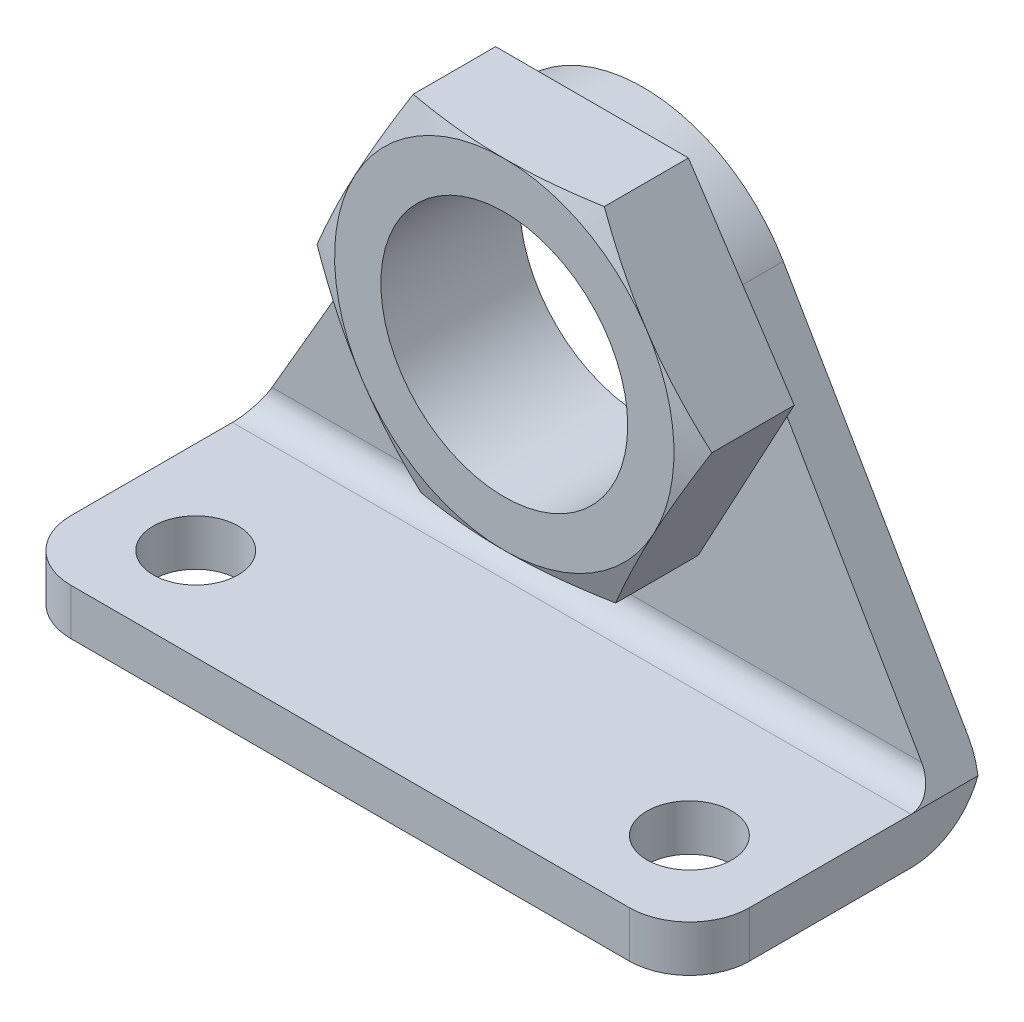
from build123d import *

# Parameters (mm, degrees)
EXTRUDE_START                   = -22
EXTRUDE_1_DEPTH                 = 44
CUT_EXTRUDE_1_DEPTH             = 10
CUT_EXTRUDE_1_DIRECTION_2_REACH = 42.869
SKETCH_6_R                      = 8
CUT_EXTRUDE_2_DEPTH             = 41.868692174
SKETCH_7_R                      = 2.75
CUT_EXTRUDE_3_DEPTH             = 41.015621949
FILLET_1_R                      = 3.9
EXTRUDE_2_DEPTH                 = 6
SKETCH_11_R                     = 8
CUT_EXTRUDE_4_DEPTH             = 42.243181255


with BuildPart() as part:
    # 草图4 → 凸台-拉伸1 (new body)
    with BuildSketch(Plane(origin=(0, 0, 0), x_dir=(0, 0, -1), z_dir=(1, 0, 0)).offset(EXTRUDE_START)):
        with BuildLine():
            Line((-19, 0), (-4.625, 0))
            ThreePointArc((-4.625, 0), (-1.354631137, 1.354631137), (0, 4.625))
            Line((0, 4.625), (0, 30.5))
            Line((0, 30.5), (-3, 30.5))
            Line((-3, 30.5), (-3, 4.625))
            ThreePointArc((-3, 4.625), (-3.475951481, 3.475951481), (-4.625, 3))
            Line((-4.625, 3), (-19, 3))
            Line((-19, 3), (-19, 0))
        make_face()
    extrude(amount=EXTRUDE_1_DEPTH)

    # 草图5 → 切除-拉伸1 (cut)
    with BuildSketch(Plane.XY.offset(3)):
        with BuildLine():
            Line((-9.082524892, 25.268561625), (-22, 3))
            Line((-22, 3), (-22, 31.5))
            Line((-22, 31.5), (22, 31.5))
            Line((22, 31.5), (22, 3))
            Line((22, 3), (9.082524892, 25.268561625))
            ThreePointArc((9.082524892, 25.268561625), (0, 30.5), (-9.082524892, 25.268561625))
        make_face()
    extrude(amount=-CUT_EXTRUDE_1_DEPTH, mode=Mode.SUBTRACT)

    # 切除-拉伸1 direction 2: up to this face of the body (flat: up to its plane)
    cut_extrude_1_direction_2_end = Plane(part.part.faces().sort_by_distance((0, 1.5, 19))[0])
    # 草图5 → 切除-拉伸1 direction 2 (cut, up to the picked face)
    with BuildSketch(Plane.XY.offset(3), mode=Mode.PRIVATE) as cut_extrude_1_direction_2_sk1:
        with BuildLine():
            Line((-9.082524892, 25.268561625), (-22, 3))
            Line((-22, 3), (-22, 31.5))
            Line((-22, 31.5), (22, 31.5))
            Line((22, 31.5), (22, 3))
            Line((22, 3), (9.082524892, 25.268561625))
            ThreePointArc((9.082524892, 25.268561625), (0, 30.5), (-9.082524892, 25.268561625))
        make_face()
    cut_extrude_1_direction_2_tool1 = split(extrude(cut_extrude_1_direction_2_sk1.sketch, amount=CUT_EXTRUDE_1_DIRECTION_2_REACH, mode=Mode.PRIVATE), bisect_by=cut_extrude_1_direction_2_end, keep=Keep.BOTH, mode=Mode.PRIVATE)
    add(cut_extrude_1_direction_2_tool1.solids().sort_by(Axis((-15.994729, 14.397326, 3), (0, 0, 1)))[0], mode=Mode.SUBTRACT)

    # 草图6 → 切除-拉伸2 (cut, through all)
    with BuildSketch(Plane.XY.offset(3)):
        with Locations((0, 20)):
            Circle(SKETCH_6_R)
    extrude(amount=-CUT_EXTRUDE_2_DEPTH, mode=Mode.SUBTRACT)

    # 草图7 → 切除-拉伸3 (cut, through all)
    with BuildSketch(Plane(origin=(0, 3, 0), x_dir=(1, 0, 0), z_dir=(0, 1, 0))):
        with Locations(Location((16, -13, 0), (0, 0, 270))):
            Circle(SKETCH_7_R)
        with Locations(Location((-16, -13, 0), (0, 0, 90))):
            Circle(SKETCH_7_R)
    extrude(amount=-CUT_EXTRUDE_3_DEPTH, mode=Mode.SUBTRACT)

    # 圆角1
    fillet_1_edges = [part.edges().sort_by_distance(p)[0] for p in [
        (-22, 1.5, 19),
        (22, 1.5, 19),
    ]]
    fillet(fillet_1_edges, radius=FILLET_1_R)

    # 草图9 → 凸台-拉伸2 (add)
    with BuildSketch(Plane.XY.offset(3)):
        Polygon((-5.937171044, 9), (6.562828956, 9), (12.797171044, 20.550578963), (5.937171044, 31), (-6.562828956, 31), (-12.797171044, 19.449421037), align=None)
    extrude(amount=EXTRUDE_2_DEPTH)

    # 草图10 → 切除-旋转1 (revolve, cut)
    with BuildSketch(Plane(origin=(0, 0, 0), x_dir=(0, 0, 1), z_dir=(1, 0, 0))):
        Polygon((9, -31), (9, -34.5), (7.72610418, -34.5), align=None)
    revolve(axis=Axis((0, 20, 71.423754158), (0, 0, -1)), mode=Mode.SUBTRACT)

    # 草图11 → 切除-拉伸4 (cut, through all)
    with BuildSketch(Plane(origin=(0, 0, 3), x_dir=(-1, 0, 0), z_dir=(0, 0, -1))):
        with Locations(Location((0, 20, 0), (0, 0, 180))):
            Circle(SKETCH_11_R)
    extrude(amount=-CUT_EXTRUDE_4_DEPTH, mode=Mode.SUBTRACT)


solid = part.part
